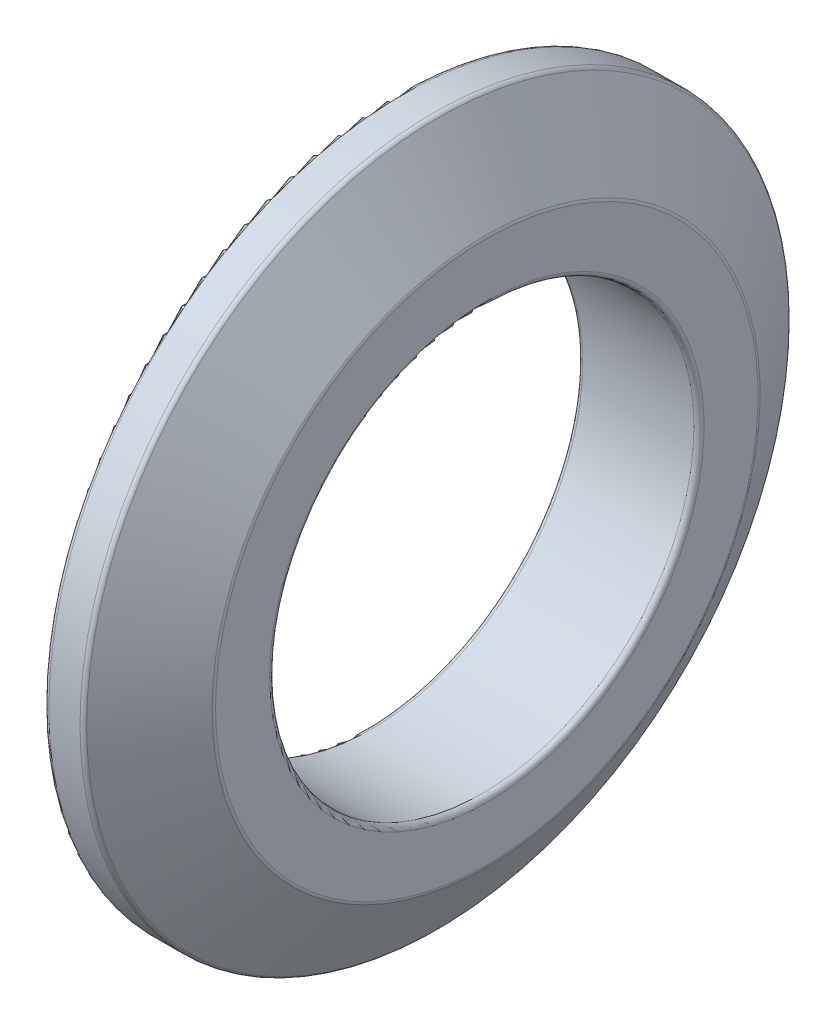
from build123d import *


with BuildPart() as part:
    # Sketch1 → Revolve1 (revolve)
    with BuildSketch(Plane.XY, mode=Mode.PRIVATE) as revolve1_sk:
        with BuildLine():
            Line((6, 10.75), (6, 13.428300943))
            ThreePointArc((6, 13.428300943), (5.990312187, 13.497221572), (5.961999576, 13.560800678))
            Line((5.961999576, 13.560800678), (3.573437666, 17.382499735))
            ThreePointArc((3.573437666, 17.382499735), (3.482630223, 17.46866062), (3.36143809, 17.5))
            Line((3.36143809, 17.5), (1.823584007, 17.5))
            ThreePointArc((1.823584007, 17.5), (1.625750278, 17.402845725), (1.581679689, 17.186894526))
            Line((1.581679689, 17.186894526), (2.918320311, 12.063105474))
            ThreePointArc((2.918320311, 12.063105474), (2.874249722, 11.847154275), (2.676415993, 11.75))
            Line((2.676415993, 11.75), (0.25, 11.75))
            ThreePointArc((0.25, 11.75), (0.073223305, 11.676776695), (0, 11.5))
            Line((0, 11.5), (0, 10.75))
            ThreePointArc((0, 10.75), (0.073223305, 10.573223305), (0.25, 10.5))
            Line((0.25, 10.5), (5.75, 10.5))
            ThreePointArc((5.75, 10.5), (5.926776695, 10.573223305), (6, 10.75))
        make_face()
    revolve(revolve1_sk.sketch.rotate(Axis((0, 0, 0), (1, 0, 0)), 90), axis=Axis((0, 0, 0), (1, 0, 0)))


solid = part.part
